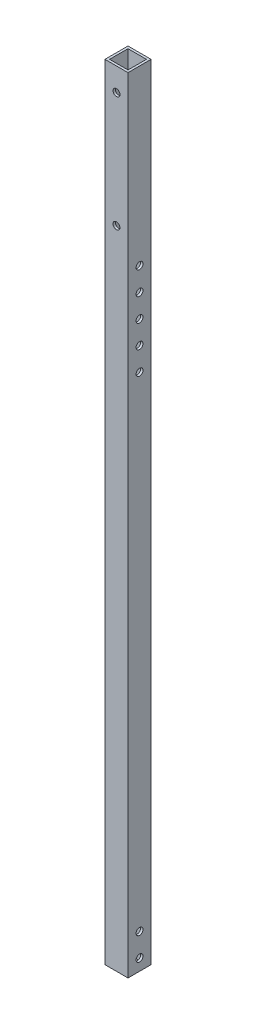
from build123d import *

# Parameters (mm, degrees)
SKETCH_1_W          = 10
SKETCH_1_H          = 10
SKETCH_1_W_2        = 8
SKETCH_1_H_2        = 8
EXTRUDE_1_DEPTH     = 340
SKETCH_2_R          = 1.5
CUT_EXTRUDE_1_DEPTH = 30
SKETCH_3_R          = 1.5
CUT_EXTRUDE_2_DEPTH = 10


with BuildPart() as part:
    # 草图1 → 凸台-拉伸1 (new body)
    with BuildSketch(Plane(origin=(0, 0, 0), x_dir=(1, 0, 0), z_dir=(0, 1, 0))):
        Rectangle(SKETCH_1_W, SKETCH_1_H)
        Rectangle(SKETCH_1_W_2, SKETCH_1_H_2, mode=Mode.SUBTRACT)
    extrude(amount=EXTRUDE_1_DEPTH)

    # 草图2 → 切除-拉伸1 (cut)
    with BuildSketch(Plane.ZY.offset(5)):
        with Locations((0, 5)):
            Circle(SKETCH_2_R)
        with Locations((0, 15)):
            Circle(SKETCH_2_R)
        with Locations((0, 225)):
            Circle(SKETCH_2_R)
        with Locations((0, 235)):
            Circle(SKETCH_2_R)
        with Locations((0, 245)):
            Circle(SKETCH_2_R)
        with Locations((0, 255)):
            Circle(SKETCH_2_R)
        with Locations((0, 265)):
            Circle(SKETCH_2_R)
    extrude(amount=-CUT_EXTRUDE_1_DEPTH, mode=Mode.SUBTRACT)

    # 草图3 → 切除-拉伸2 (cut)
    with BuildSketch(Plane(origin=(0, 0, -5), x_dir=(-1, 0, 0), z_dir=(0, 0, -1))):
        with Locations((0, 280)):
            Circle(SKETCH_3_R)
        with Locations((0, 330)):
            Circle(SKETCH_3_R)
    extrude(amount=-CUT_EXTRUDE_2_DEPTH, mode=Mode.SUBTRACT)


solid = part.part
